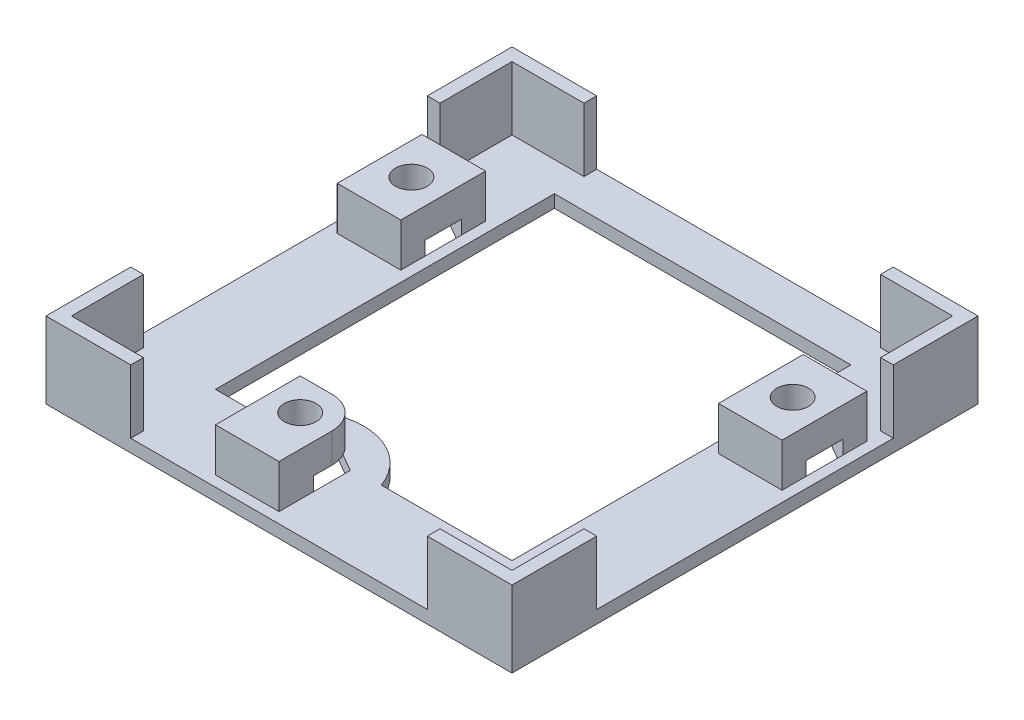
from build123d import *

# Parameters (mm, degrees)
SKETCH1_W           = 44
SKETCH1_H           = 44
SKETCH1_R           = 1.5
BOSS_EXTRUDE1_DEPTH = 1.2
BOSS_EXTRUDE4_DEPTH = 6
SKETCH5_W           = 6
SKETCH5_H           = 8
BOSS_EXTRUDE8_DEPTH = 4.1
SKETCH1_3_R         = 1.5
CUT_EXTRUDE1_DEPTH  = 2.5
SKETCH1_4_R         = 1.5
CUT_EXTRUDE2_DEPTH  = 63.640561939


with BuildPart() as part:
    # Sketch1 → Boss-Extrude1 (new body)
    with BuildSketch(Plane(origin=(0, 0, 0), x_dir=(1, 0, 0), z_dir=(0, 1, 0))):
        with Locations((22, 22)):
            Rectangle(SKETCH1_W, SKETCH1_H)
        with BuildLine():
            Line((36, 8), (23.656854249, 8))
            ThreePointArc((23.656854249, 8), (18, 12), (12.343145751, 8))
            Line((12.343145751, 8), (8, 8))
            Line((8, 8), (8, 40))
            Line((8, 40), (36, 40))
            Line((36, 40), (36, 8))
        make_face(mode=Mode.SUBTRACT)
        with Locations((18, 6)):
            Circle(SKETCH1_R, mode=Mode.SUBTRACT)
        with Locations((4, 30.5)):
            Circle(SKETCH1_R, mode=Mode.SUBTRACT)
        with Locations((40, 30.5)):
            Circle(SKETCH1_R, mode=Mode.SUBTRACT)
    extrude(amount=BOSS_EXTRUDE1_DEPTH)

    # Sketch4 → Boss-Extrude4 (add)
    with BuildSketch(Plane(origin=(0, 1.2, 0), x_dir=(1, 0, 0), z_dir=(0, 1, 0))):
        Polygon((8, 44), (0, 44), (0, 36), (1.2, 36), (1.2, 42.8), (8, 42.8), align=None)
        Polygon((44, 44), (36, 44), (36, 42.8), (42.8, 42.8), (42.8, 36), (44, 36), align=None)
        Polygon((1.2, 8), (0, 8), (0, 0), (8, 0), (8, 1.2), (1.2, 1.2), align=None)
        Polygon((44, 8), (42.8, 8), (42.8, 1.2), (36, 1.2), (36, 0), (44, 0), align=None)
    extrude(amount=BOSS_EXTRUDE4_DEPTH)

    # Sketch5 → Boss-Extrude8 (add)
    with BuildSketch(Plane(origin=(0, 1.2, 0), x_dir=(1, 0, 0), z_dir=(0, 1, 0))):
        with Locations((4, 30.5)):
            Rectangle(SKETCH5_W, SKETCH5_H)
        with Locations((40, 30.5)):
            Rectangle(SKETCH5_W, SKETCH5_H)
        with BuildLine():
            Line((15, 9), (18, 9))
            ThreePointArc((18, 9), (20.121320344, 8.121320344), (21, 6))
            Line((21, 6), (21, 1))
            Line((21, 1), (15, 1))
            Line((15, 1), (15, 9))
        make_face()
    extrude(amount=BOSS_EXTRUDE8_DEPTH)

    # Sketch1<3> → Cut-Extrude1 (cut)
    # profile 1 of 3: a face of its own
    with BuildSketch(Plane(origin=(0, 0, 0), x_dir=(1, 0, 0), z_dir=(0, 1, 0))):
        Polygon((4, 33.964101615), (1, 32.232050808), (1, 28.767949192), (4, 27.035898385), (7, 28.767949192), (7, 32.232050808), align=None)
        with Locations((4, 30.5)):
            Circle(SKETCH1_3_R, mode=Mode.SUBTRACT)
    # profile 2 of 3: a face of its own
    with BuildSketch(Plane(origin=(0, 0, 0), x_dir=(1, 0, 0), z_dir=(0, 1, 0))):
        Polygon((40, 33.964101615), (37, 32.232050808), (37, 28.767949192), (40, 27.035898385), (43, 28.767949192), (43, 32.232050808), align=None)
        with Locations((40, 30.5)):
            Circle(SKETCH1_3_R, mode=Mode.SUBTRACT)
    # profile 3 of 3: a face of its own
    with BuildSketch(Plane(origin=(0, 0, 0), x_dir=(1, 0, 0), z_dir=(0, 1, 0))):
        Polygon((18, 9.464101615), (15, 7.732050808), (15, 4.267949192), (18, 2.535898385), (21, 4.267949192), (21, 7.732050808), align=None)
        with Locations((18, 6)):
            Circle(SKETCH1_3_R, mode=Mode.SUBTRACT)
    extrude(amount=CUT_EXTRUDE1_DEPTH, mode=Mode.SUBTRACT)

    # Sketch1<4> → Cut-Extrude2 (cut, through all)
    with BuildSketch(Plane(origin=(0, 0, 0), x_dir=(1, 0, 0), z_dir=(0, 1, 0))):
        with Locations((4, 30.5)):
            Circle(SKETCH1_4_R)
        with Locations((40, 30.5)):
            Circle(SKETCH1_4_R)
        with Locations((18, 6)):
            Circle(SKETCH1_4_R)
    extrude(amount=CUT_EXTRUDE2_DEPTH, mode=Mode.SUBTRACT)


solid = part.part
